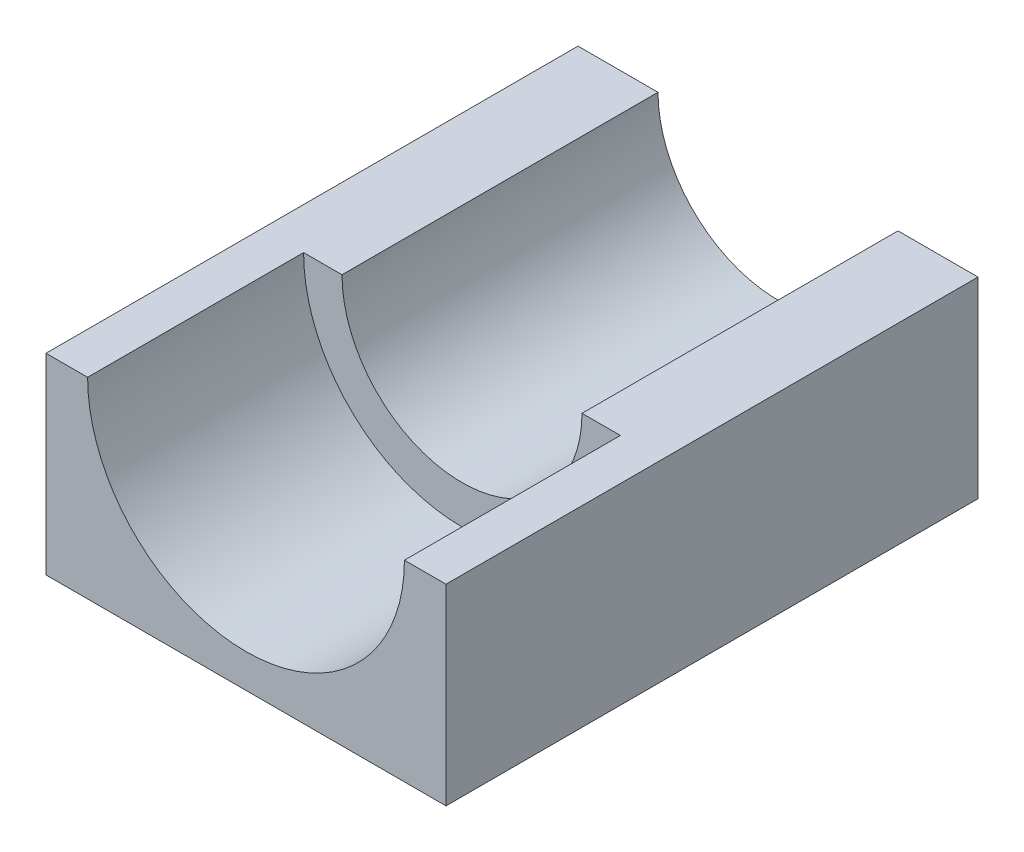
from build123d import *

# Parameters (mm, degrees)
BOSS_EXTRUDE1_DEPTH = 66.5
SKETCH4_R           = 19.8
CUT_EXTRUDE1_DEPTH  = 27
SKETCH5_R           = 15
CUT_EXTRUDE2_DEPTH  = 52.738521814


with BuildPart() as part:
    # Sketch1 → Boss-Extrude1 (new body)
    with BuildSketch(Plane.XY):
        Polygon((-20.582022726, -5.70241059), (-20.582022726, 8.150480999), (29.417977274, 8.150480999), (29.417977274, -11.649519001), (29.417977274, -15.849519001), (-20.582022726, -15.849519001), align=None)
    extrude(amount=-BOSS_EXTRUDE1_DEPTH)

    # Sketch4 → Cut-Extrude1 (cut)
    with BuildSketch(Plane.XY):
        with Locations((4.417977274, 8.150480999)):
            Circle(SKETCH4_R)
    extrude(amount=-CUT_EXTRUDE1_DEPTH, mode=Mode.SUBTRACT)

    # Sketch5 → Cut-Extrude2 (cut, through all)
    with BuildSketch(Plane.XY.offset(-27)):
        with Locations((4.417977274, 8.150480999)):
            Circle(SKETCH5_R)
    extrude(amount=-CUT_EXTRUDE2_DEPTH, mode=Mode.SUBTRACT)


solid = part.part
